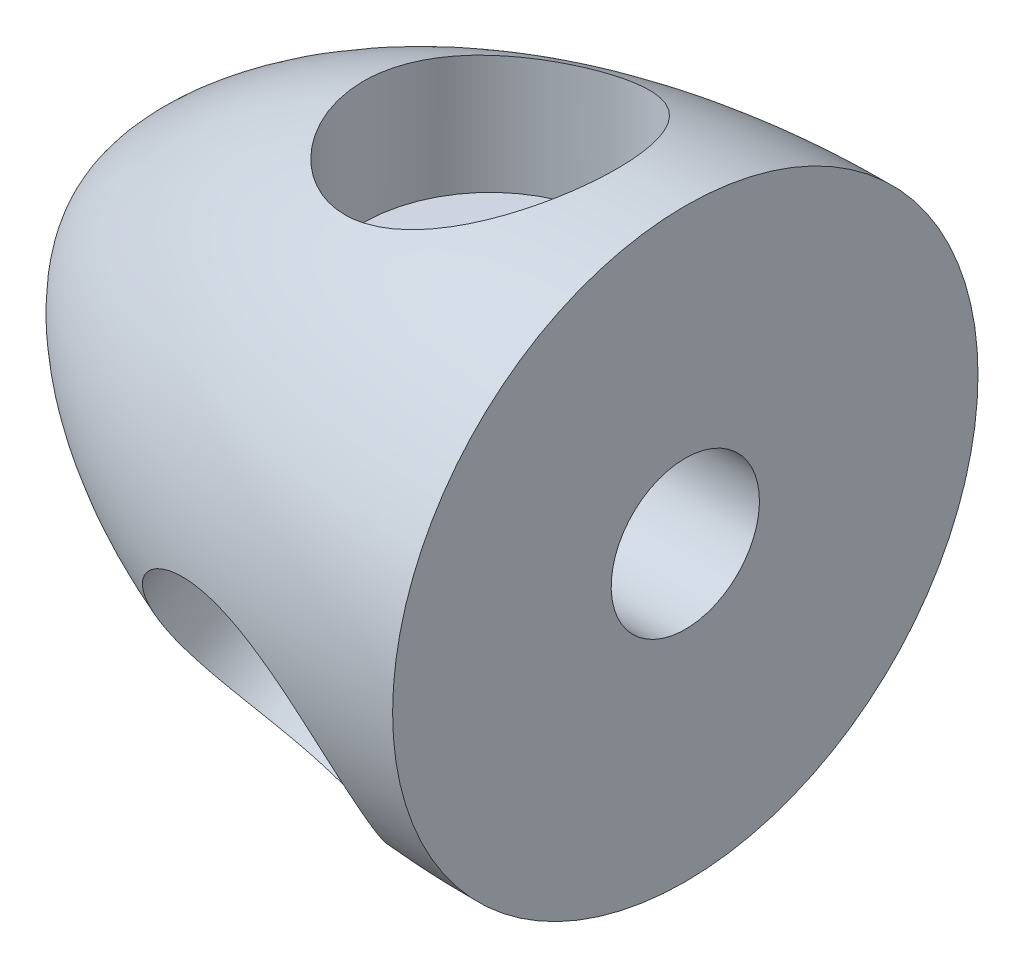
from build123d import *

# Parameters (mm, degrees)
SKETCH5_R          = 8.255
CUT_EXTRUDE1_DEPTH = 11.43
CIRPATTERN1_COUNT  = 3
SKETCH6_R          = 4.825
CUT_EXTRUDE2_DEPTH = 12.7


with BuildPart() as part:
    # Sketch4 → Revolve1 (revolve)
    with BuildSketch(Plane.XY):
        with BuildLine():
            Line((0, 0), (-38.1, 0))
            add(Edge.make_bspline(
                [(0, 19.05), (-25.433333333, 19.05), (-38.1, 6.3), (-38.1, 0)],
                knots=[0, 0, 0, 0, 1, 1, 1, 1], degree=3))
            Line((0, 19.05), (0, 0))
        make_face()
    revolve(axis=Axis((0, 0, 0), (-1, 0, 0)))

    # Sketch5 → Cut-Extrude1 (cut)
    with BuildSketch(Plane(origin=(0, 19.05, 0), x_dir=(1, 0, 0), z_dir=(0, 1, 0))):
        with Locations(Location((-12.7, 0, 0), (0, 0, 270))):
            Circle(SKETCH5_R)
    cut_extrude1 = extrude(amount=-CUT_EXTRUDE1_DEPTH, mode=Mode.SUBTRACT)

    # CirPattern1: Cut-Extrude1 ×3 about axis
    cirpattern1_axis = Axis((0, 0, 0), (1, 0, 0))
    for i in range(1, CIRPATTERN1_COUNT):
        add(cut_extrude1.rotate(cirpattern1_axis, i * 360 / CIRPATTERN1_COUNT), mode=Mode.SUBTRACT)

    # Sketch6 → Cut-Extrude2 (cut)
    with BuildSketch(Plane(origin=(0, 0, 0), x_dir=(0, 0, -1), z_dir=(1, 0, 0))):
        with Locations(Location((0, 0, 0), (0, 0, 90))):
            Circle(SKETCH6_R)
    extrude(amount=-CUT_EXTRUDE2_DEPTH, mode=Mode.SUBTRACT)


solid = part.part
